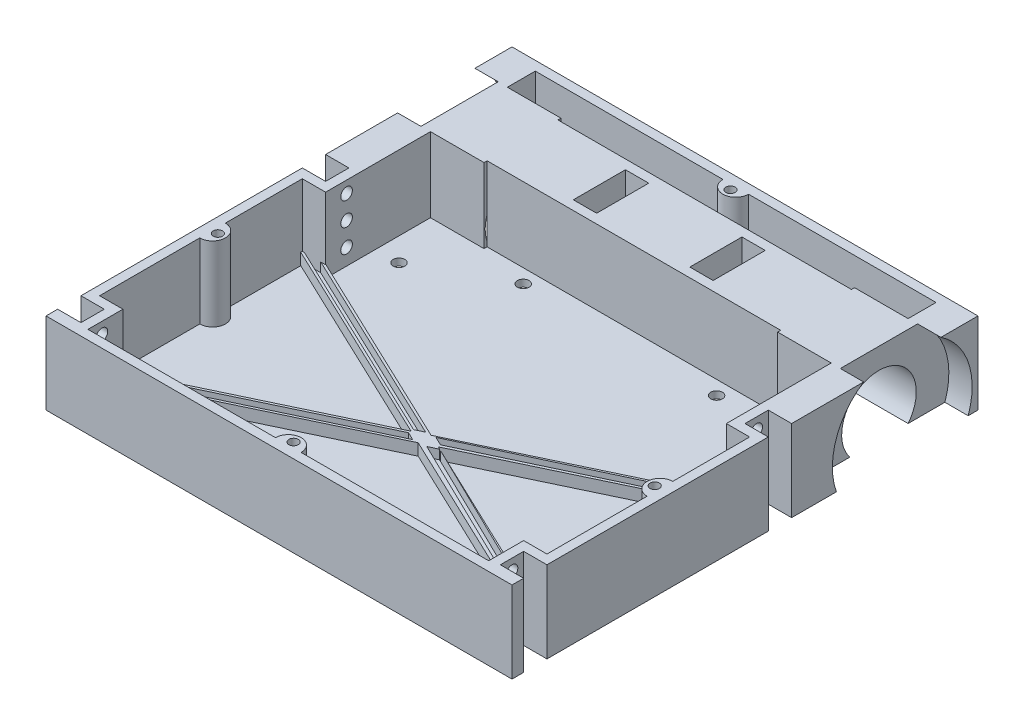
from build123d import *

# Parameters (mm, degrees)
ESQUISSE2_W              = 200
ESQUISSE2_H              = 200
BASE_DEPTH               = 35
ESQUISSE3_R              = 15
BLOC_MOTEUR_1_DEPTH      = 80
ESQUISSE4_W              = 10
ESQUISSE4_H              = 22.360679774
ACCES_MOTEUR_DEPTH       = 37
ESQUISSE6_R              = 16.01
BLOC_MOTEUR_2_DEPTH      = 37
ESQUISSE7_R              = 2.5
VIS_MOTEUR_DEPTH         = 146.688022843
ESQUISSE8_R              = 2.5
VIS_PATIN_DEPTH          = 146.688022843
ESQUISSE12_R             = 30
ESPACE_ROUE_DEPTH        = 10
ESQUISSE23_W             = 10
ESQUISSE23_H             = 35
VIDE_TIGE_DEPTH          = 10
VIDE_VIS_REACH           = 219.543
ESQUISSE25_R             = 2.5
VIDE_START               = -1
VIDE_BASE_DEPTH          = 32
BOSS_CROIX_DEPTH         = 4
BOSS_CROIX_DEPTH_BACK    = 2.5
ESQUISSE30_R             = 2
BOSS_VIS_DEPTH           = 35
VIDE_START_2             = -5
ESQUISSE31_R             = 2
VIDE_VIS_COUVERCLE_DEPTH = 5
VIDE_CROIX_DEPTH         = 4


with BuildPart() as part:
    # Esquisse2 → BASE (new body)
    with BuildSketch(Plane(origin=(0, 0, 0), x_dir=(1, 0, 0), z_dir=(0, 1, 0))):
        Rectangle(ESQUISSE2_W, ESQUISSE2_H)
    extrude(amount=BASE_DEPTH)

    # Esquisse3 → BLOC MOTEUR 1. (cut)
    with BuildSketch(Plane(origin=(100, 0, 0), x_dir=(0, 0, -1), z_dir=(1, 0, 0))):
        with Locations((67.5, 10)):
            Circle(ESQUISSE3_R)
    bloc_moteur_1 = extrude(amount=-BLOC_MOTEUR_1_DEPTH, mode=Mode.SUBTRACT)

    # Esquisse4 → ACCES MOTEUR (cut)
    with BuildSketch(Plane.XZ):
        with Locations((25, -67.5)):
            Rectangle(ESQUISSE4_W, ESQUISSE4_H)
    acces_moteur = extrude(amount=-ACCES_MOTEUR_DEPTH, mode=Mode.SUBTRACT)

    # Esquisse6 → BLOC MOTEUR 2 (cut)
    with BuildSketch(Plane(origin=(100, 0, 0), x_dir=(0, 0, -1), z_dir=(1, 0, 0))):
        with Locations((67.5, 10)):
            Circle(ESQUISSE6_R)
    bloc_moteur_2 = extrude(amount=-BLOC_MOTEUR_2_DEPTH, mode=Mode.SUBTRACT)

    # SYM BLOC MOTEUR: BLOC MOTEUR 1., ACCES MOTEUR, BLOC MOTEUR 2 across plane
    add(bloc_moteur_1.mirror(Plane(origin=(0, 0, 0), x_dir=(0, 0, 1), z_dir=(1, 0, 0))), mode=Mode.SUBTRACT)
    add(acces_moteur.mirror(Plane(origin=(0, 0, 0), x_dir=(0, 0, 1), z_dir=(1, 0, 0))), mode=Mode.SUBTRACT)
    add(bloc_moteur_2.mirror(Plane(origin=(0, 0, 0), x_dir=(0, 0, 1), z_dir=(1, 0, 0))), mode=Mode.SUBTRACT)

    # Esquisse7 → VIS MOTEUR (cut, through all)
    with BuildSketch(Plane.XZ):
        with Locations(Location((-76, -27.497129837, 0), (0, 0, 270))):
            Circle(ESQUISSE7_R)
        with Locations(Location((-41.5, -46.319660113, 0), (0, 0, 270))):
            Circle(ESQUISSE7_R)
        with Locations(Location((-41.5, -88.680339887, 0), (0, 0, 270))):
            Circle(ESQUISSE7_R)
        with Locations(Location((-76, -90.002803686, 0), (0, 0, 270))):
            Circle(ESQUISSE7_R)
    vis_moteur = extrude(amount=-VIS_MOTEUR_DEPTH, mode=Mode.SUBTRACT)

    # SYM VIS: VIS MOTEUR across plane
    add(vis_moteur.mirror(Plane(origin=(0, 0, 0), x_dir=(0, 0, 1), z_dir=(1, 0, 0))), mode=Mode.SUBTRACT)

    # Esquisse8 → VIS PATIN (cut, through all)
    with BuildSketch(Plane.XZ):
        with Locations(Location((-55, 77.5, 0), (0, 0, 270))):
            Circle(ESQUISSE8_R)
        with Locations(Location((55, 77.5, 0), (0, 0, 270))):
            Circle(ESQUISSE8_R)
    extrude(amount=-VIS_PATIN_DEPTH, mode=Mode.SUBTRACT)

    # Esquisse12 → ESPACE ROUE (cut)
    with BuildSketch(Plane.ZY.offset(100)):
        with Locations((-67.5, 10)):
            Circle(ESQUISSE12_R)
    espace_roue = extrude(amount=-ESPACE_ROUE_DEPTH, mode=Mode.SUBTRACT)

    # SYM ESPACE ROUE: ESPACE ROUE across plane
    add(espace_roue.mirror(Plane(origin=(0, 0, 0), x_dir=(0, 0, 1), z_dir=(1, 0, 0))), mode=Mode.SUBTRACT)

    # Esquisse23 → VIDE TIGE (cut)
    with BuildSketch(Plane(origin=(100, 0, 0), x_dir=(0, 0, -1), z_dir=(1, 0, 0))):
        with Locations((-90, 17.5)):
            Rectangle(ESQUISSE23_W, ESQUISSE23_H)
        with Locations((15, 17.5)):
            Rectangle(ESQUISSE23_W, ESQUISSE23_H)
    vide_tige = extrude(amount=-VIDE_TIGE_DEPTH, mode=Mode.SUBTRACT)

    # SYM TIGE: VIDE TIGE across plane
    add(vide_tige.mirror(Plane(origin=(0, 0, 0), x_dir=(0, 0, 1), z_dir=(1, 0, 0))), mode=Mode.SUBTRACT)

    # Esquisse25 → VIDE VIS (cut, up to next)
    with BuildSketch(Plane(origin=(90, 0, 0), x_dir=(0, 0, -1), z_dir=(1, 0, 0)), mode=Mode.PRIVATE) as vide_vis_sk1:
        with Locations((-90, 30)):
            Circle(ESQUISSE25_R)
    vide_vis_tool1 = extrude(vide_vis_sk1.sketch, amount=-VIDE_VIS_REACH, mode=Mode.PRIVATE) & part.part
    # Esquisse25 → VIDE VIS (cut, up to next)
    with BuildSketch(Plane(origin=(90, 0, 0), x_dir=(0, 0, -1), z_dir=(1, 0, 0)), mode=Mode.PRIVATE) as vide_vis_sk2:
        with Locations((-90, 20)):
            Circle(ESQUISSE25_R)
    vide_vis_tool2 = extrude(vide_vis_sk2.sketch, amount=-VIDE_VIS_REACH, mode=Mode.PRIVATE) & part.part
    # Esquisse25 → VIDE VIS (cut, up to next)
    with BuildSketch(Plane(origin=(90, 0, 0), x_dir=(0, 0, -1), z_dir=(1, 0, 0)), mode=Mode.PRIVATE) as vide_vis_sk3:
        with Locations((-90, 10)):
            Circle(ESQUISSE25_R)
    vide_vis_tool3 = extrude(vide_vis_sk3.sketch, amount=-VIDE_VIS_REACH, mode=Mode.PRIVATE) & part.part
    # Esquisse25 → VIDE VIS (cut, up to next)
    with BuildSketch(Plane(origin=(90, 0, 0), x_dir=(0, 0, -1), z_dir=(1, 0, 0)), mode=Mode.PRIVATE) as vide_vis_sk4:
        with Locations(Location((15, 10, 0), (0, 0, 180))):
            Circle(ESQUISSE25_R)
    vide_vis_tool4 = extrude(vide_vis_sk4.sketch, amount=-VIDE_VIS_REACH, mode=Mode.PRIVATE) & part.part
    # Esquisse25 → VIDE VIS (cut, up to next)
    with BuildSketch(Plane(origin=(90, 0, 0), x_dir=(0, 0, -1), z_dir=(1, 0, 0)), mode=Mode.PRIVATE) as vide_vis_sk5:
        with Locations(Location((15, 30, 0), (0, 0, 180))):
            Circle(ESQUISSE25_R)
    vide_vis_tool5 = extrude(vide_vis_sk5.sketch, amount=-VIDE_VIS_REACH, mode=Mode.PRIVATE) & part.part
    # Esquisse25 → VIDE VIS (cut, up to next)
    with BuildSketch(Plane(origin=(90, 0, 0), x_dir=(0, 0, -1), z_dir=(1, 0, 0)), mode=Mode.PRIVATE) as vide_vis_sk6:
        with Locations(Location((15, 20, 0), (0, 0, 180))):
            Circle(ESQUISSE25_R)
    vide_vis_tool6 = extrude(vide_vis_sk6.sketch, amount=-VIDE_VIS_REACH, mode=Mode.PRIVATE) & part.part
    add(vide_vis_tool1.solids().sort_by_distance((90, 30, 90))[0], mode=Mode.SUBTRACT)
    add(vide_vis_tool2.solids().sort_by_distance((90, 20, 90))[0], mode=Mode.SUBTRACT)
    add(vide_vis_tool3.solids().sort_by_distance((90, 10, 90))[0], mode=Mode.SUBTRACT)
    add(vide_vis_tool4.solids().sort_by_distance((90, 10, -15))[0], mode=Mode.SUBTRACT)
    add(vide_vis_tool5.solids().sort_by_distance((90, 30, -15))[0], mode=Mode.SUBTRACT)
    add(vide_vis_tool6.solids().sort_by_distance((90, 20, -15))[0], mode=Mode.SUBTRACT)

    # Esquisse27 → VIDE BASE (cut)
    with BuildSketch(Plane(origin=(0, 4, 0), x_dir=(1, 0, 0), z_dir=(0, 1, 0)).offset(VIDE_START)):
        Polygon((-96, -81), (-96, 6), (-86, 6), (-86, 16.142194012), (-86, 50.997196314), (-63, 50.997196314), (-63, 52.319660113), (63, 52.319660113), (63, 50.997196314), (86, 50.997196314), (86, 16.142194012), (86, 6), (96, 6), (96, -81), (86, -81), (86, -96), (-86, -96), (-86, -81), align=None)
        Polygon((-86, 84.002803686), (-63, 84.002803686), (-63, 82.680339887), (63, 82.680339887), (63, 84.002803686), (86, 84.002803686), (86, 96), (-86, 96), align=None)
    extrude(amount=VIDE_BASE_DEPTH, mode=Mode.SUBTRACT)

    # Esquisse29 → BOSS - CROIX (add, two sides: drawn at the far end of the back side and taken through both)
    with BuildSketch(Plane(origin=(0, 4, 0), x_dir=(1, 0, 0), z_dir=(0, 1, 0)).offset(-BOSS_CROIX_DEPTH_BACK)):
        Polygon((-48.536422017, -57.78710173), (-52.983113657, -59.899280259), (-100, -82.232301272), (-100, -85), (-94.173265835, -85), (0, -40.267698728), (94.173265835, -85), (100, -85), (100, -82.232301272), (58.158948273, -62.357801701), (53.712256633, -60.245623173), (5.826734165, -37.5), (100, 7.232301272), (100, 10), (94.173265835, 10), (0, -34.732301272), (-94.173265835, 10), (-100, 10), (-100, 7.232301272), (-5.826734165, -37.5), align=None)
    extrude(amount=BOSS_CROIX_DEPTH + BOSS_CROIX_DEPTH_BACK)

    # Esquisse30 → BOSS VIS (add)
    # profile 1 of 4: a face of its own
    with BuildSketch(Plane(origin=(0, 35, 0), x_dir=(1, 0, 0), z_dir=(0, 1, 0))):
        with BuildLine():
            Line((-5.5, 96), (5.5, 96))
            ThreePointArc((5.5, 96), (0, 90.5), (-5.5, 96))
        make_face()
        with Locations(Location((0, 93.75, 0), (0, 0, 270))):
            Circle(ESQUISSE30_R, mode=Mode.SUBTRACT)
    # profile 2 of 4: a face of its own
    with BuildSketch(Plane(origin=(0, 35, 0), x_dir=(1, 0, 0), z_dir=(0, 1, 0))):
        with BuildLine():
            Line((-5.5, -96), (5.5, -96))
            ThreePointArc((5.5, -96), (0, -90.5), (-5.5, -96))
        make_face()
        with Locations(Location((0, -93.75, 0), (0, 0, 270))):
            Circle(ESQUISSE30_R, mode=Mode.SUBTRACT)
    # profile 3 of 4: a face of its own
    with BuildSketch(Plane(origin=(0, 35, 0), x_dir=(1, 0, 0), z_dir=(0, 1, 0))):
        with BuildLine():
            Line((-96, -27), (-96, -38))
            ThreePointArc((-96, -38), (-90.5, -32.5), (-96, -27))
        make_face()
        with Locations(Location((-93.75, -32.5, 0), (0, 0, 270))):
            Circle(ESQUISSE30_R, mode=Mode.SUBTRACT)
    # profile 4 of 4: a face of its own
    with BuildSketch(Plane(origin=(0, 35, 0), x_dir=(1, 0, 0), z_dir=(0, 1, 0))):
        with BuildLine():
            Line((96, -27), (96, -38))
            ThreePointArc((96, -38), (90.5, -32.5), (96, -27))
        make_face()
        with Locations(Location((93.75, -32.5, 0), (0, 0, 90))):
            Circle(ESQUISSE30_R, mode=Mode.SUBTRACT)
    extrude(amount=-BOSS_VIS_DEPTH)

    # Esquisse31 → VIDE VIS COUVERCLE (cut)
    with BuildSketch(Plane.XZ.offset(VIDE_START_2)):
        with Locations(Location((0, 93.75, 0), (0, 0, 90))):
            Circle(ESQUISSE31_R)
        with Locations(Location((-93.75, 32.5, 0), (0, 0, 90))):
            Circle(ESQUISSE31_R)
        with Locations(Location((0, -93.75, 0), (0, 0, 90))):
            Circle(ESQUISSE31_R)
        with Locations(Location((93.75, 32.5, 0), (0, 0, 270))):
            Circle(ESQUISSE31_R)
    extrude(amount=VIDE_VIS_COUVERCLE_DEPTH, mode=Mode.SUBTRACT)

    # Esquisse36 → VIDE CROIX (cut)
    with BuildSketch(Plane(origin=(0, 4, 0), x_dir=(1, 0, 0), z_dir=(0, 1, 0))):
        Polygon((-95.074987867, -81), (-5.826734165, -38.607079491), (-2.330693666, -40.267698728), (-88.08290687, -81), align=None)
        Polygon((-5.826734165, -36.392920509), (-95.074987867, 6), (-88.08290687, 6), (-2.330693666, -34.732301272), align=None)
        Polygon((88.08290687, -81), (3.248024719, -39.831966478), (7.000943139, -38.049330228), (95.074987867, -81), align=None)
        Polygon((88.08290687, 6), (1.82038942, -34.489906755), (5.57330784, -36.272543005), (95.074987867, 6), align=None)
    extrude(amount=VIDE_CROIX_DEPTH, mode=Mode.SUBTRACT)


solid = part.part
